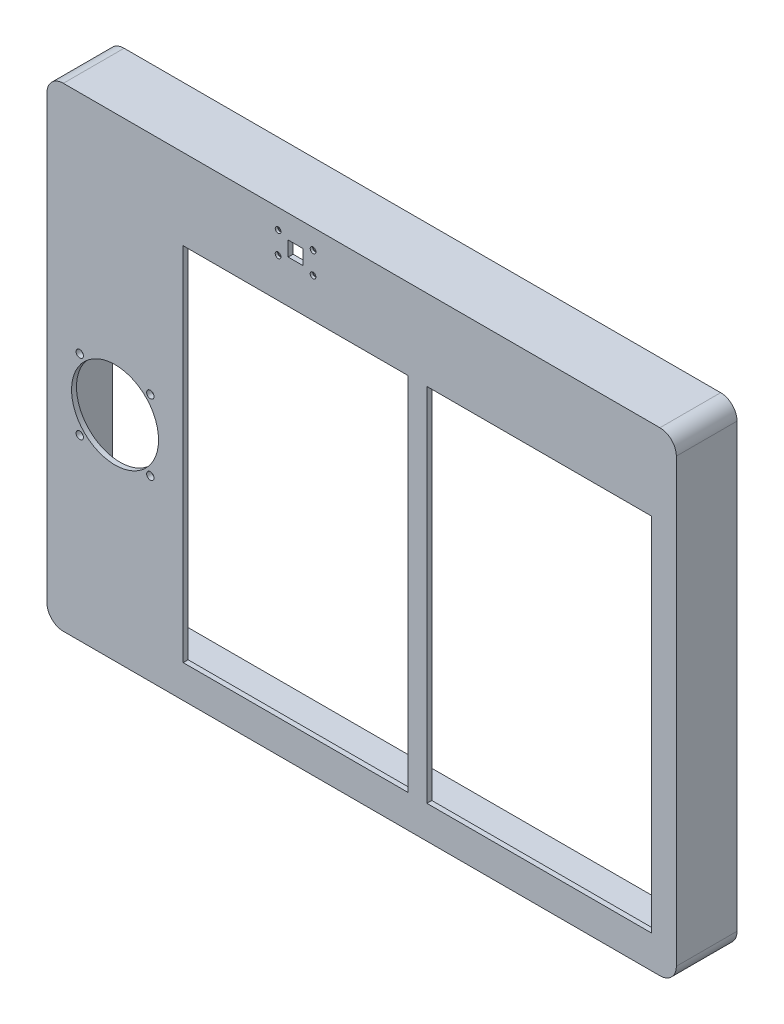
from build123d import *

# Parameters (mm, degrees)
EXTRUDE_1_DEPTH      = 37
SHELL_4_T            = -3
SKETCH_1_8_R         = 2.25
SKETCH_1_8_R_2       = 26.5
SKETCH_1_8_R_3       = 1.25
SKETCH_1_8_W         = 137
SKETCH_1_8_H         = 220
SKETCH_1_8_W_2       = 9
SKETCH_1_8_H_2       = 9
CUT_EXTRUDE_8_DEPTH  = 3
SKETCH_1_9_R         = 1.75
CUT_EXTRUDE_9_DEPTH  = 1.5
CUT_EXTRUDE_10_DEPTH = 3


with BuildPart() as part:
    # 草图1 → 凸台-拉伸1 (new body)
    with BuildSketch(Plane.XY):
        with BuildLine():
            Line((-68, 39.2), (295.5, 39.2))
            ThreePointArc((295.5, 39.2), (302.571067812, 36.271067812), (305.5, 29.2))
            Line((305.5, 29.2), (305.5, -240))
            ThreePointArc((305.5, -240), (302.571067812, -247.071067812), (295.5, -250))
            Line((295.5, -250), (-68, -250))
            ThreePointArc((-68, -250), (-75.071067812, -247.071067812), (-78, -240))
            Line((-78, -240), (-78, 29.2))
            ThreePointArc((-78, 29.2), (-75.071067812, 36.271067812), (-68, 39.2))
        make_face()
    extrude(amount=-EXTRUDE_1_DEPTH)

    # 抽壳4
    shell_4_openings = [part.faces().sort_by_distance(p)[0] for p in [
        (113.75, -105.4, -37),
    ]]
    offset(amount=SHELL_4_T, openings=shell_4_openings, kind=Kind.INTERSECTION)

    # 草图1<8> → 切除-拉伸8 (cut)
    with BuildSketch(Plane.XY):
        with Locations((-58, -98.5)):
            Circle(SKETCH_1_8_R)
        with Locations((-36.5, -120)):
            Circle(SKETCH_1_8_R_2)
        with Locations((-15, -98.5)):
            Circle(SKETCH_1_8_R)
        with Locations((-15, -141.5)):
            Circle(SKETCH_1_8_R)
        with Locations((-58, -141.5)):
            Circle(SKETCH_1_8_R)
        with Locations((62.85, 27.2)):
            Circle(SKETCH_1_8_R_3)
        with Locations((84.15, 27.2)):
            Circle(SKETCH_1_8_R_3)
        with Locations((84.15, 13.9)):
            Circle(SKETCH_1_8_R_3)
        with Locations((62.85, 13.9)):
            Circle(SKETCH_1_8_R_3)
        with Locations((73.5, -120)):
            Rectangle(SKETCH_1_8_W, SKETCH_1_8_H)
        with Locations((222, -120)):
            Rectangle(SKETCH_1_8_W, SKETCH_1_8_H)
        with Locations((73.5, 20.5)):
            Rectangle(SKETCH_1_8_W_2, SKETCH_1_8_H_2)
    extrude(amount=-CUT_EXTRUDE_8_DEPTH, mode=Mode.SUBTRACT)

    # 草图1<9> → 切除-拉伸9 (cut)
    with BuildSketch(Plane.XY):
        with Locations((62.85, 27.2)):
            Circle(SKETCH_1_9_R)
        with Locations((84.15, 27.2)):
            Circle(SKETCH_1_9_R)
        with Locations((84.15, 13.9)):
            Circle(SKETCH_1_9_R)
        with Locations((62.85, 13.9)):
            Circle(SKETCH_1_9_R)
    extrude(amount=-CUT_EXTRUDE_9_DEPTH, mode=Mode.SUBTRACT)

    # 草图2 → 切除-拉伸10 (cut)
    with BuildSketch(Plane.ZY.offset(78)):
        with BuildLine():
            Line((-19.5, -100.8), (-18.5, -100.8))
            ThreePointArc((-18.5, -100.8), (-16.025126266, -101.825126266), (-15, -104.3))
            Line((-15, -104.3), (-15, -108.3))
            ThreePointArc((-15, -108.3), (-16.025126266, -110.774873734), (-18.5, -111.8))
            Line((-18.5, -111.8), (-19.5, -111.8))
            ThreePointArc((-19.5, -111.8), (-21.974873734, -110.774873734), (-23, -108.3))
            Line((-23, -108.3), (-23, -104.3))
            ThreePointArc((-23, -104.3), (-21.974873734, -101.825126266), (-19.5, -100.8))
        make_face()
    extrude(amount=-CUT_EXTRUDE_10_DEPTH, mode=Mode.SUBTRACT)


solid = part.part
